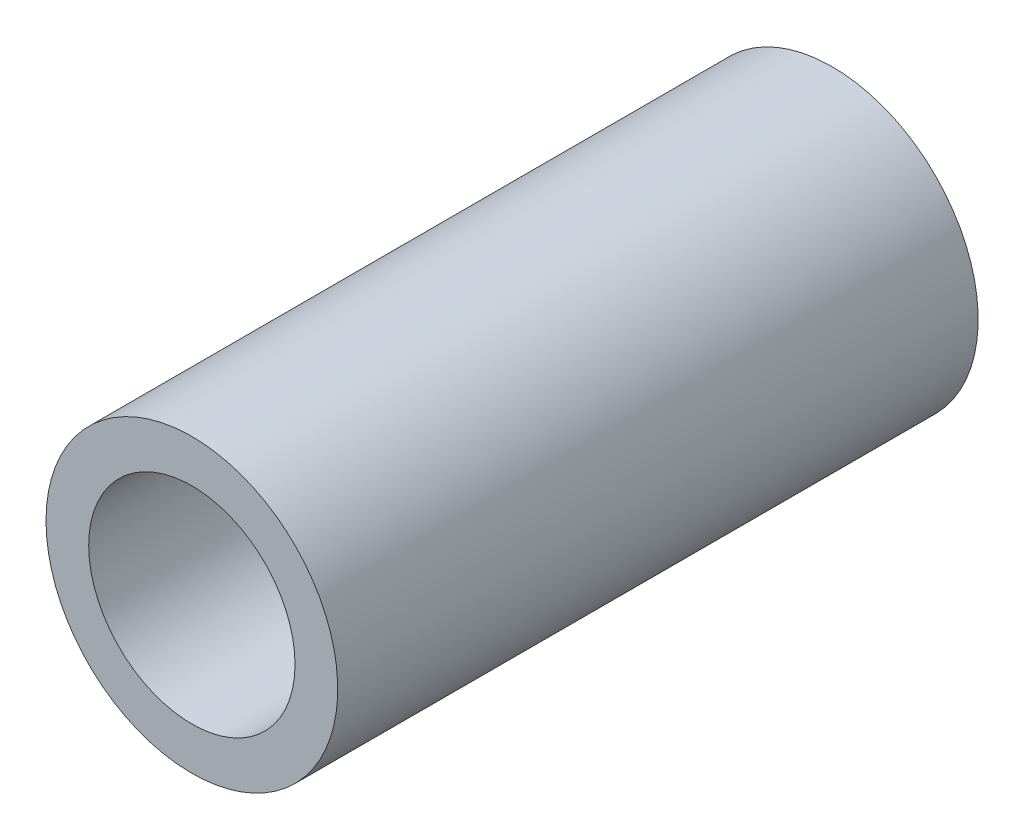
from build123d import *

# Parameters (mm, degrees)
ESBO_O1_R                = 10.25
ESBO_O1_R_2              = 7.25
RESSALTO_EXTRUS_O1_DEPTH = 22.5


with BuildPart() as part:
    # Esboço1 → Ressalto-extrusão1 (new, symmetric)
    with BuildSketch(Plane.XY):
        with Locations(Location((0, 0, 0), (0, 0, 180))):
            Circle(ESBO_O1_R)
        with Locations(Location((0, 0, 0), (0, 0, 180))):
            Circle(ESBO_O1_R_2, mode=Mode.SUBTRACT)
    extrude(amount=RESSALTO_EXTRUS_O1_DEPTH, both=True)


solid = part.part
